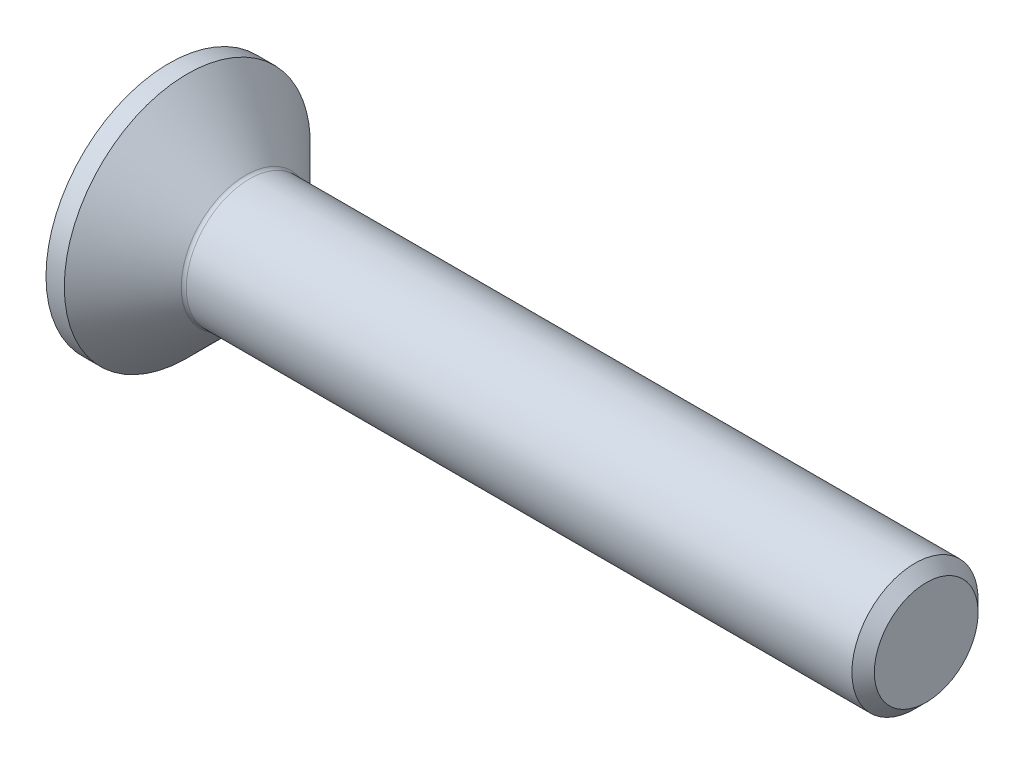
from build123d import *

# Parameters (mm, degrees)
FILLET1_R   = 0.2
HEX_2_DEPTH = 1.9


with BuildPart() as part:
    # BodySke → BaseBody (revolve)
    with BuildSketch(Plane.XY, mode=Mode.PRIVATE) as basebody_sk:
        Polygon((0, 0), (0, 4.875), (0.725, 4.875), (3.1, 2.5), (29.555, 2.5), (30, 2.055), (30, 0), align=None)
    revolve(basebody_sk.sketch.rotate(Axis((0, 0, 0), (1, 0, 0)), 90), axis=Axis((0, 0, 0), (1, 0, 0)))

    # Fillet1
    fillet1_edges = [part.edges().sort_by_distance(p)[0] for p in [
        (3.1, 0, -2.5),
    ]]
    fillet(fillet1_edges, radius=FILLET1_R)

    # Sketch2 → PreBroach (revolve, cut)
    with BuildSketch(Plane.XY, mode=Mode.PRIVATE) as prebroach_sk:
        Polygon((0, 1.5), (1.9, 1.5), (2.766025404, 0), (0, 0), align=None)
    revolve(prebroach_sk.sketch.rotate(Axis((0, 0, 0), (1, 0, 0)), 90), axis=Axis((0, 0, 0), (1, 0, 0)), mode=Mode.SUBTRACT)

    # Sketch3 → Hex 2 (cut)
    with BuildSketch(Plane.ZY):
        Polygon((-1.5, -0.866025404), (-1.5, 0.866025404), (0, 1.732050808), (1.5, 0.866025404), (1.5, -0.866025404), (0, -1.732050808), align=None)
    extrude(amount=-HEX_2_DEPTH, mode=Mode.SUBTRACT)


solid = part.part
